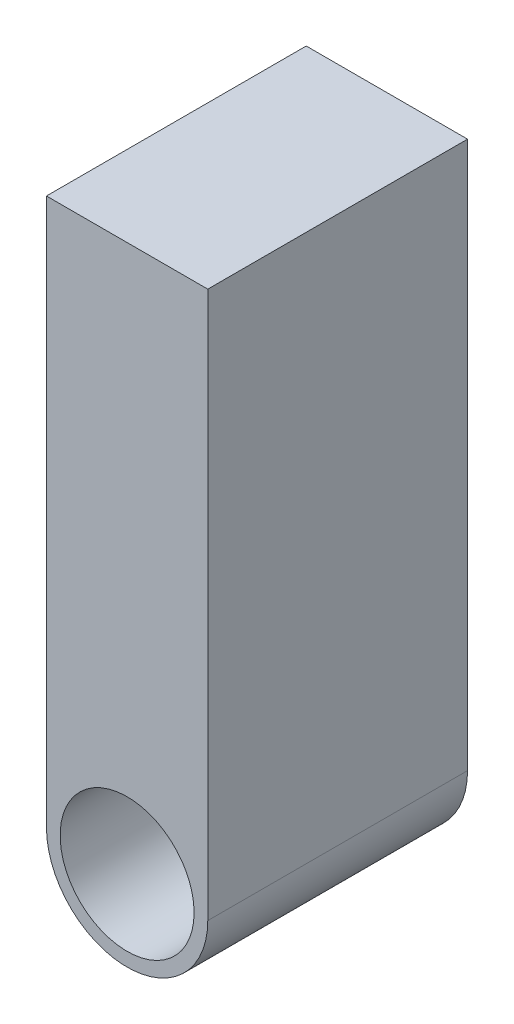
from build123d import *

# Parameters (mm, degrees)
BOSS_EXTRUDE1_DEPTH = 48.26
SKETCH3_R           = 12.446
CUT_EXTRUDE1_DEPTH  = 44.196
SKETCH4_R           = 3.175
CUT_EXTRUDE2_DEPTH  = 40.64


with BuildPart() as part:
    # Sketch2 → Boss-Extrude1 (new body)
    with BuildSketch(Plane.XY):
        with BuildLine():
            Line((-14.986, 0), (-14.986, 101.6))
            Line((-14.986, 101.6), (14.986, 101.6))
            Line((14.986, 101.6), (14.986, 0))
            ThreePointArc((14.986, 0), (0, -14.986), (-14.986, 0))
        make_face()
    extrude(amount=BOSS_EXTRUDE1_DEPTH)

    # Sketch3 → Cut-Extrude1 (cut)
    with BuildSketch(Plane.XY.offset(48.26)):
        Circle(SKETCH3_R)
    extrude(amount=-CUT_EXTRUDE1_DEPTH, mode=Mode.SUBTRACT)

    # Sketch4 → Cut-Extrude2 (cut)
    with BuildSketch(Plane(origin=(0, 0, 0), x_dir=(-1, 0, 0), z_dir=(0, 0, -1))):
        Circle(SKETCH4_R)
    extrude(amount=-CUT_EXTRUDE2_DEPTH, mode=Mode.SUBTRACT)


solid = part.part
